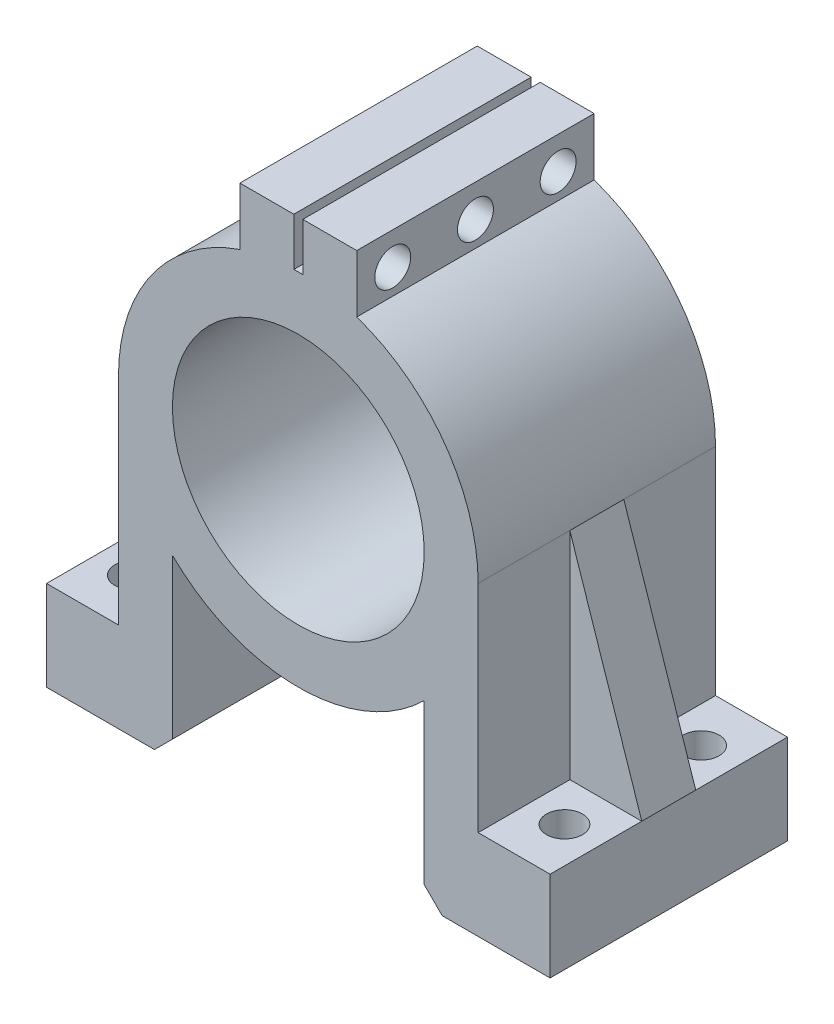
from build123d import *

# Parameters (mm, degrees)
SKETCH1_R           = 7
BOSS_EXTRUDE1_DEPTH = 13.2
HOLE1_D             = 2
HOLE1_DEPTH         = 30
HOLE2_D             = 2
HOLE2_DEPTH         = 30
BOSS_EXTRUDE2_DEPTH = 1.5
CHAMFER1_SIZE       = 1


with BuildPart() as part:
    # Sketch1 → Boss-Extrude1 (new body)
    with BuildSketch(Plane.XY):
        with BuildLine():
            Line((-14, 0), (-14, 5))
            Line((-14, 5), (-10, 5))
            Line((-10, 5), (-10, 17))
            ThreePointArc((-10, 17), (-8.139410298, 22.809475019), (-3.25, 26.45714016))
            Line((-3.25, 26.45714016), (-3.25, 29.65714016))
            Line((-3.25, 29.65714016), (-0.25, 29.65714016))
            Line((-0.25, 29.65714016), (-0.25, 26.996874512))
            ThreePointArc((-0.25, 26.996874512), (0, 27), (0.25, 26.996874512))
            Line((0.25, 26.996874512), (0.25, 29.65714016))
            Line((0.25, 29.65714016), (3.25, 29.65714016))
            Line((3.25, 29.65714016), (3.25, 26.45714016))
            ThreePointArc((3.25, 26.45714016), (8.139410298, 22.809475019), (10, 17))
            Line((10, 17), (10, 5))
            Line((10, 5), (14, 5))
            Line((14, 5), (14, 0))
            Line((14, 0), (7, 0))
            Line((7, 0), (7, 9.858571571))
            ThreePointArc((7, 9.858571571), (0, 7), (-7, 9.858571571))
            Line((-7, 9.858571571), (-7, 0))
            Line((-7, 0), (-14, 0))
        make_face()
        with Locations((0, 17)):
            Circle(SKETCH1_R, mode=Mode.SUBTRACT)
    extrude(amount=BOSS_EXTRUDE1_DEPTH)

    # Hole1
    with Locations(Plane(origin=(3.25, 0, 0), x_dir=(0, 0, -1), z_dir=(1, 0, 0))):
        with Locations((-11.2, 27.85714016), (-2, 27.85714016), (-6.6, 27.85714016)):
            Hole(HOLE1_D / 2, depth=HOLE1_DEPTH)

    # Hole2
    with Locations(Plane(origin=(0, 5, 0), x_dir=(1, 0, 0), z_dir=(0, 1, 0))):
        with Locations((12, -2.8), (12, -10.4)):
            hole2 = Hole(HOLE2_D / 2, depth=HOLE2_DEPTH)

    # Mirror1: Hole2 across plane
    add(hole2.mirror(Plane(origin=(0, 0, 0), x_dir=(0, 0, 1), z_dir=(1, 0, 0))), mode=Mode.SUBTRACT)

    # Sketch6 → Boss-Extrude2 (add, symmetric)
    with BuildSketch(Plane.XY.offset(6.6)):
        Polygon((10, 17), (14, 5), (10, 5), align=None)
    boss_extrude2 = extrude(amount=BOSS_EXTRUDE2_DEPTH, both=True)

    # Mirror2: Boss-Extrude2 across plane
    add(boss_extrude2.mirror(Plane(origin=(0, 0, 0), x_dir=(0, 0, 1), z_dir=(1, 0, 0))))

    # Chamfer1
    chamfer1_edges = [part.edges().sort_by_distance(p)[0] for p in [
        (7, 0, 6.6),
        (-7, 0, 6.6),
    ]]
    chamfer(chamfer1_edges, length=CHAMFER1_SIZE)


solid = part.part
